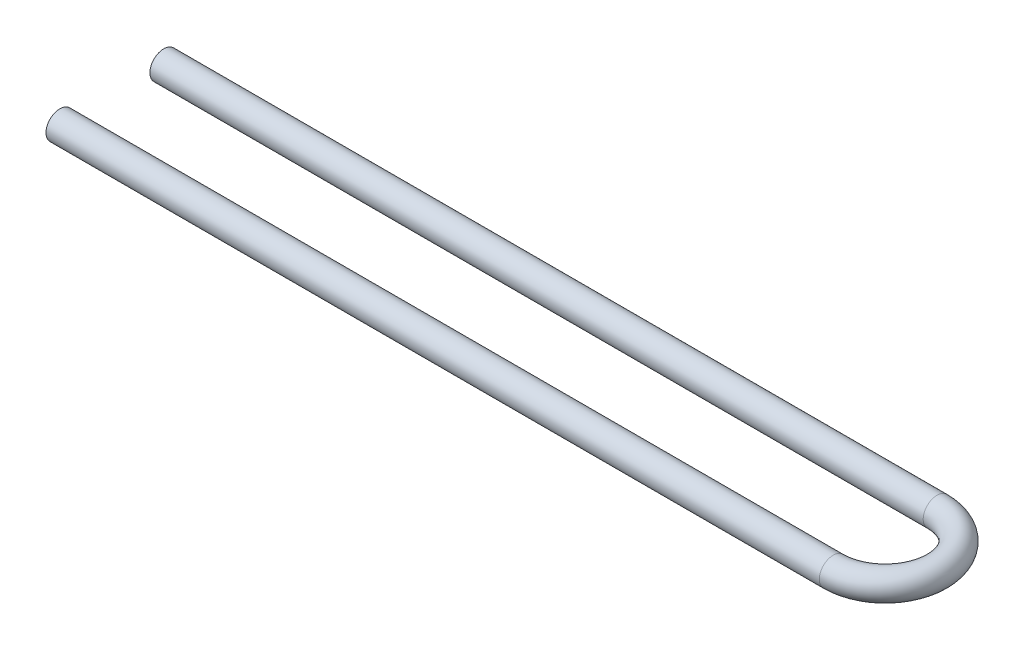
from build123d import *

# Parameters (mm, degrees)
SKETCH_2_R = 1


with BuildPart() as part:
    # По траектории1: sweep along a path in Эскиз1
    with BuildLine(Plane(origin=(0, 0, 0), x_dir=(1, 0, 0), z_dir=(0, 1, 0))) as sweep_1_path:
        Line((0, -7.5), (55.82324902, -7.5))
        ThreePointArc((55.82324902, -7.5), (59.57324902, -3.75), (55.82324902, 0))
        Line((55.82324902, 0), (0, 0))
    # Эскиз2 → По траектории1 (sweep)
    with BuildSketch(Plane(origin=(0, 0, 0), x_dir=(0, 0, -1), z_dir=(1, 0, 0))):
        Circle(SKETCH_2_R)
    sweep(path=sweep_1_path.line)


solid = part.part
